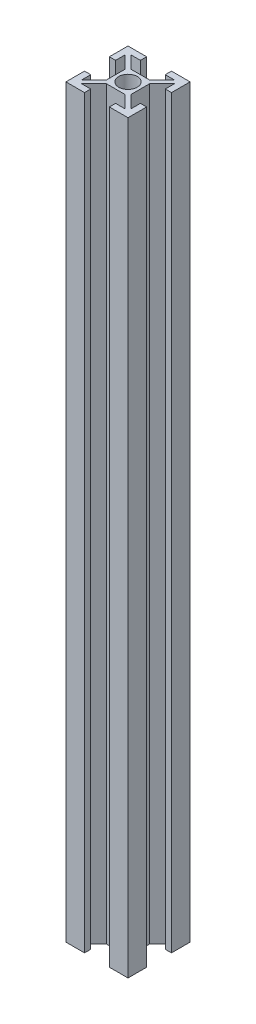
from build123d import *

# Parameters (mm, degrees)
F_2020_SKETCH_R     = 3
BOSS_EXTRUDE1_DEPTH = 240


with BuildPart() as part:
    # 2020 sketch → Boss-Extrude1 (new body)
    with BuildSketch(Plane(origin=(0, 0, 0), x_dir=(1, 0, 0), z_dir=(0, 1, 0))):
        Polygon((-4, 10), (-4, 8), (-7, 8), (-3, 4), (3, 4), (7, 8), (4, 8), (4, 10), (10, 10), (10, 4), (8, 4), (8, 7), (4, 3), (4, -3), (8, -7), (8, -4), (10, -4), (10, -10), (4, -10), (4, -8), (7, -8), (3, -4), (-3, -4), (-7, -8), (-4, -8), (-4, -10), (-10, -10), (-10, -4), (-8, -4), (-8, -7), (-4, -3), (-4, 3), (-8, 7), (-8, 4), (-10, 4), (-10, 10), align=None)
        with Locations(Location((0, 0, 0), (0, 0, 270))):
            Circle(F_2020_SKETCH_R, mode=Mode.SUBTRACT)
    extrude(amount=BOSS_EXTRUDE1_DEPTH)


solid = part.part
